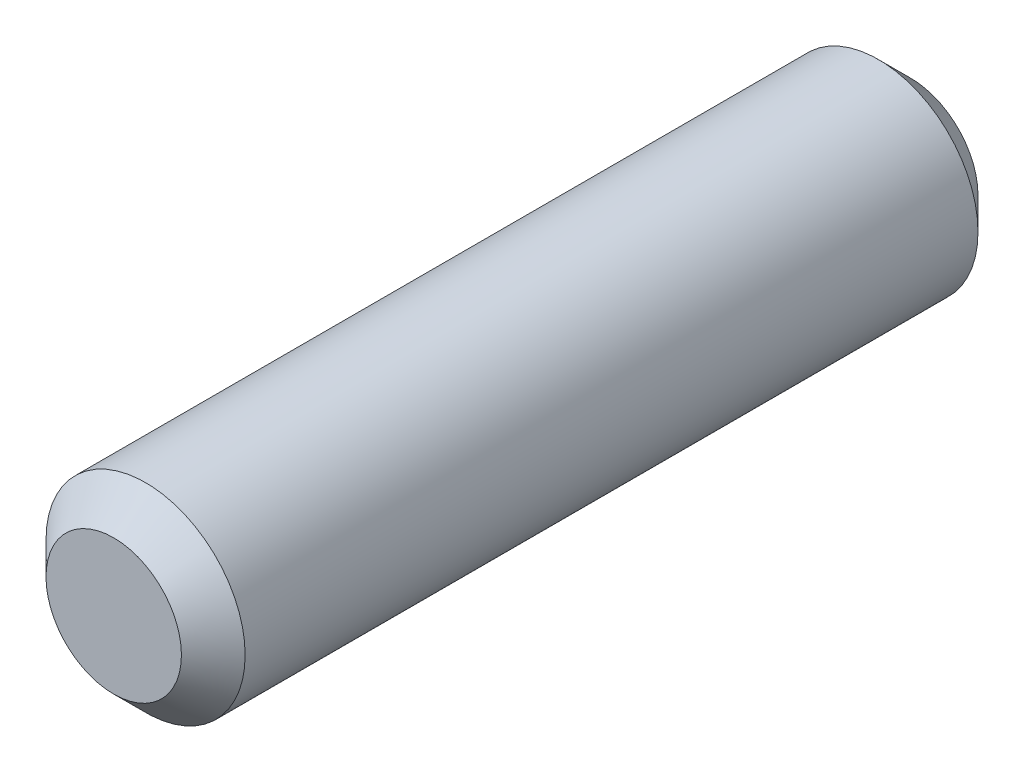
from build123d import *

# Parameters (mm, degrees)
SKETCH1_R           = 1.190625
BOSS_EXTRUDE1_DEPTH = 4.7625
CHAMFER1_SIZE       = 0.381


with BuildPart() as part:
    # Sketch1 → Boss-Extrude1 (new, symmetric)
    with BuildSketch(Plane.XY):
        with Locations(Location((0, 0, 0), (0, 0, 180))):
            Circle(SKETCH1_R)
    extrude(amount=BOSS_EXTRUDE1_DEPTH, both=True)

    # Chamfer1
    chamfer1_edges = [part.edges().sort_by_distance(p)[0] for p in [
        (1.190625, 0, -4.7625),
        (1.190625, 0, 4.7625),
    ]]
    chamfer(chamfer1_edges, length=CHAMFER1_SIZE)


solid = part.part
